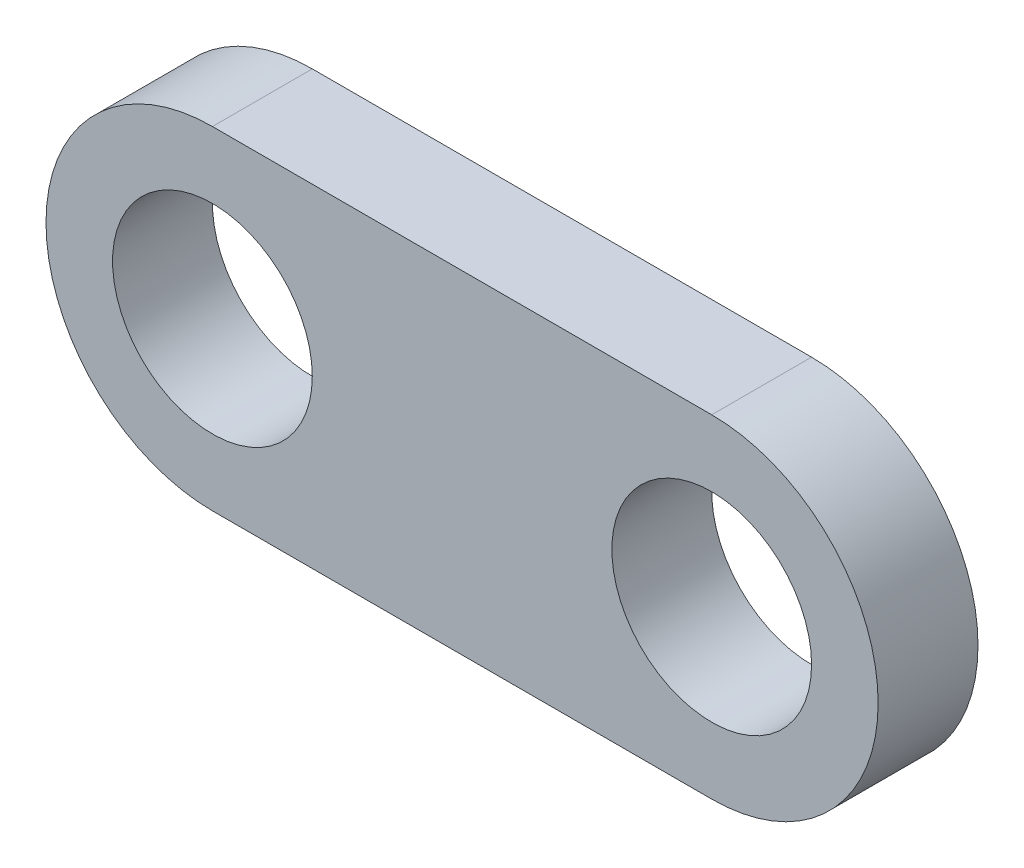
from build123d import *

# Parameters (mm, degrees)
SKETCH_1_R      = 3
EXTRUDE_1_DEPTH = 3


with BuildPart() as part:
    # ｽｹｯﾁ1 → ﾎﾞｽ - 押し出し1 (new body)
    with BuildSketch(Plane.XY):
        with BuildLine():
            Line((-7.5, 5), (7.5, 5))
            ThreePointArc((7.5, 5), (12.5, 0), (7.5, -5))
            Line((7.5, -5), (-7.5, -5))
            ThreePointArc((-7.5, -5), (-12.5, 0), (-7.5, 5))
        make_face()
        with Locations((-7.5, 0)):
            Circle(SKETCH_1_R, mode=Mode.SUBTRACT)
        with Locations((7.5, 0)):
            Circle(SKETCH_1_R, mode=Mode.SUBTRACT)
    extrude(amount=EXTRUDE_1_DEPTH)


solid = part.part
